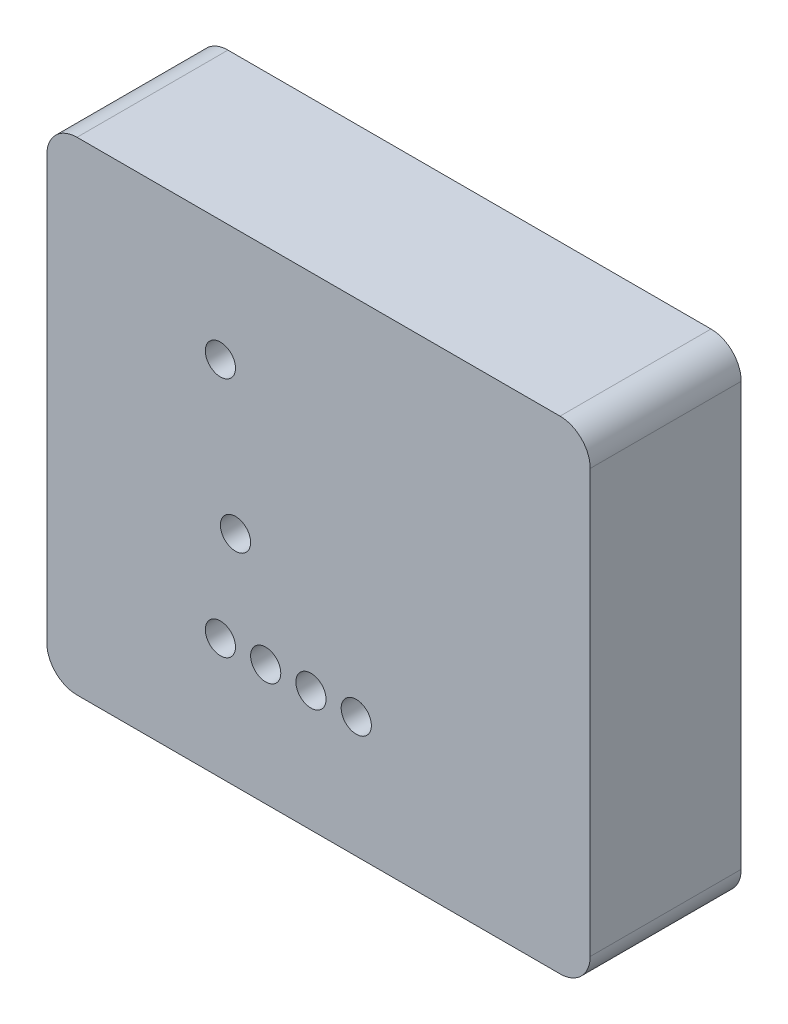
from build123d import *

# Parameters (mm, degrees)
SKETCH1_W           = 18
SKETCH1_H           = 16
SKETCH1_R           = 0.5
BOSS_EXTRUDE1_DEPTH = 5
FILLET2_R           = 1
FILLET3_R           = 1
FILLET4_R           = 1
FILLET5_R           = 1


with BuildPart() as part:
    # Sketch1 → Boss-Extrude1 (new body)
    with BuildSketch(Plane.XY):
        with Locations((9, 8)):
            Rectangle(SKETCH1_W, SKETCH1_H)
        with Locations((5.75, 4)):
            Circle(SKETCH1_R, mode=Mode.SUBTRACT)
        with Locations((7.25, 4)):
            Circle(SKETCH1_R, mode=Mode.SUBTRACT)
        with Locations((8.75, 4)):
            Circle(SKETCH1_R, mode=Mode.SUBTRACT)
        with Locations((10.25, 4)):
            Circle(SKETCH1_R, mode=Mode.SUBTRACT)
        with Locations((5.75, 12)):
            Circle(SKETCH1_R, mode=Mode.SUBTRACT)
        with Locations((6.25, 7.25)):
            Circle(SKETCH1_R, mode=Mode.SUBTRACT)
    extrude(amount=BOSS_EXTRUDE1_DEPTH)

    # Fillet2
    fillet2_edges = [part.edges().sort_by_distance(p)[0] for p in [
        (0, 0, 2.5),
    ]]
    fillet(fillet2_edges, radius=FILLET2_R)

    # Fillet3
    fillet3_edges = [part.edges().sort_by_distance(p)[0] for p in [
        (0, 16, 2.5),
    ]]
    fillet(fillet3_edges, radius=FILLET3_R)

    # Fillet4
    fillet4_edges = [part.edges().sort_by_distance(p)[0] for p in [
        (18, 16, 2.5),
    ]]
    fillet(fillet4_edges, radius=FILLET4_R)

    # Fillet5
    fillet5_edges = [part.edges().sort_by_distance(p)[0] for p in [
        (18, 0, 2.5),
    ]]
    fillet(fillet5_edges, radius=FILLET5_R)


solid = part.part
